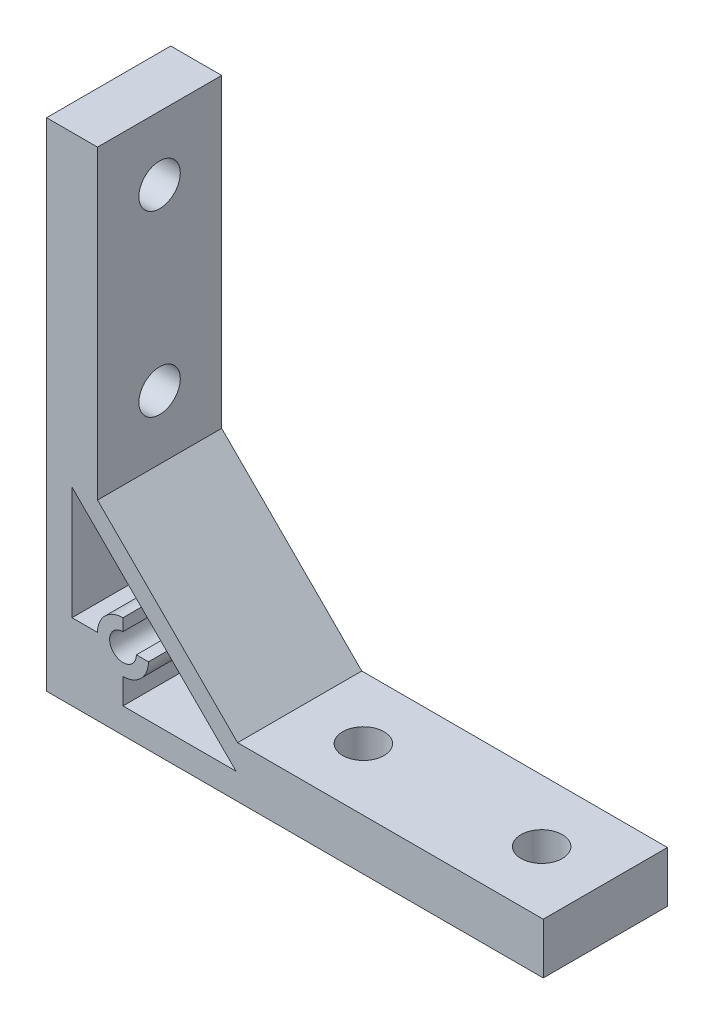
from build123d import *

# Parameters (mm, degrees)
EXTRUDE_1_DEPTH     = 19.5
CUT_EXTRUDE_1_REACH = 114.019
EXTRUDE_2_DEPTH     = 19.5
CUT_EXTRUDE_2_REACH = 114.019
SKETCH_4_R          = 2.1
CUT_EXTRUDE_3_REACH = 108.603
SKETCH_5_R          = 3.25
CUT_EXTRUDE_4_REACH = 108.603
SKETCH_6_R          = 3.25


with BuildPart() as part:
    # 草图1 → 凸台-拉伸1 (new body)
    with BuildSketch(Plane.XY):
        Polygon((0, 0), (78, 0), (78, 8), (30, 8), (8, 30), (8, 78), (0, 78), align=None)
    extrude(amount=EXTRUDE_1_DEPTH)

    # 草图2 → 切除-拉伸1 (cut, up to next)
    with BuildSketch(Plane.XY.offset(19.5), mode=Mode.PRIVATE) as cut_extrude_1_sk1:
        Polygon((4, 29.757359313), (29.757359313, 4), (12, 4), (12, 12), (4, 12), align=None)
    cut_extrude_1_tool1 = extrude(cut_extrude_1_sk1.sketch, amount=-CUT_EXTRUDE_1_REACH, mode=Mode.PRIVATE) & part.part
    add(cut_extrude_1_tool1.solids().sort_by_distance((13.682042, 13.682042, 19.5))[0], mode=Mode.SUBTRACT)

    # 草图3 → 凸台-拉伸2 (add)
    with BuildSketch(Plane.XY.offset(19.5)):
        with BuildLine():
            Line((12, 12), (12, 16))
            ThreePointArc((12, 16), (9.171572875, 9.171572875), (16, 12))
            Line((16, 12), (12, 12))
        make_face()
    extrude(amount=-EXTRUDE_2_DEPTH)

    # 草图4 → 切除-拉伸2 (cut, up to next)
    with BuildSketch(Plane.XY.offset(19.5), mode=Mode.PRIVATE) as cut_extrude_2_sk1:
        with Locations((12, 12)):
            Circle(SKETCH_4_R)
    cut_extrude_2_tool1 = extrude(cut_extrude_2_sk1.sketch, amount=-CUT_EXTRUDE_2_REACH, mode=Mode.PRIVATE) & part.part
    add(cut_extrude_2_tool1.solids().sort_by_distance((12, 12, 19.5))[0], mode=Mode.SUBTRACT)

    # 草图5 → 切除-拉伸3 (cut, up to next)
    with BuildSketch(Plane(origin=(0, 8, 0), x_dir=(1, 0, 0), z_dir=(0, 1, 0)), mode=Mode.PRIVATE) as cut_extrude_3_sk1:
        with Locations(Location((40, -9.75, 0), (0, 0, 180))):
            Circle(SKETCH_5_R)
    cut_extrude_3_tool1 = extrude(cut_extrude_3_sk1.sketch, amount=-CUT_EXTRUDE_3_REACH, mode=Mode.PRIVATE) & part.part
    # 草图5 → 切除-拉伸3 (cut, up to next)
    with BuildSketch(Plane(origin=(0, 8, 0), x_dir=(1, 0, 0), z_dir=(0, 1, 0)), mode=Mode.PRIVATE) as cut_extrude_3_sk2:
        with Locations(Location((68, -9.75, 0), (0, 0, 180))):
            Circle(SKETCH_5_R)
    cut_extrude_3_tool2 = extrude(cut_extrude_3_sk2.sketch, amount=-CUT_EXTRUDE_3_REACH, mode=Mode.PRIVATE) & part.part
    add(cut_extrude_3_tool1.solids().sort_by_distance((40, 8, 9.75))[0], mode=Mode.SUBTRACT)
    add(cut_extrude_3_tool2.solids().sort_by_distance((68, 8, 9.75))[0], mode=Mode.SUBTRACT)

    # 草图6 → 切除-拉伸4 (cut, up to next)
    with BuildSketch(Plane(origin=(8, 0, 0), x_dir=(0, 0, -1), z_dir=(1, 0, 0)), mode=Mode.PRIVATE) as cut_extrude_4_sk1:
        with Locations((-9.75, 68)):
            Circle(SKETCH_6_R)
    cut_extrude_4_tool1 = extrude(cut_extrude_4_sk1.sketch, amount=-CUT_EXTRUDE_4_REACH, mode=Mode.PRIVATE) & part.part
    # 草图6 → 切除-拉伸4 (cut, up to next)
    with BuildSketch(Plane(origin=(8, 0, 0), x_dir=(0, 0, -1), z_dir=(1, 0, 0)), mode=Mode.PRIVATE) as cut_extrude_4_sk2:
        with Locations((-9.75, 40)):
            Circle(SKETCH_6_R)
    cut_extrude_4_tool2 = extrude(cut_extrude_4_sk2.sketch, amount=-CUT_EXTRUDE_4_REACH, mode=Mode.PRIVATE) & part.part
    add(cut_extrude_4_tool1.solids().sort_by_distance((8, 68, 9.75))[0], mode=Mode.SUBTRACT)
    add(cut_extrude_4_tool2.solids().sort_by_distance((8, 40, 9.75))[0], mode=Mode.SUBTRACT)


solid = part.part
